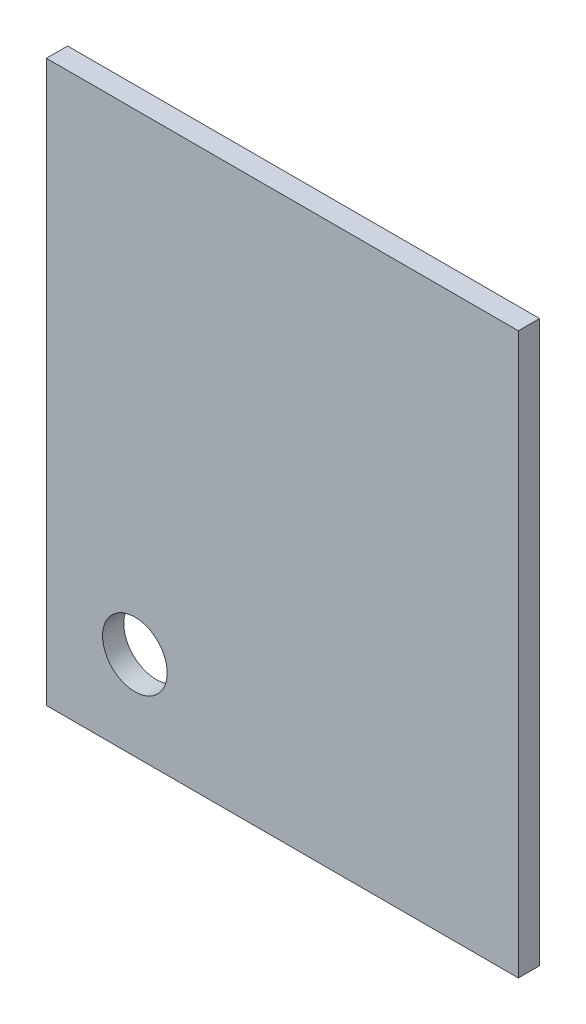
from build123d import *

# Parameters (mm, degrees)
SKETCH1_W      = 50.8
SKETCH1_H      = 60.325
SKETCH1_R      = 3.480052618
EXTRUDE2_DEPTH = 2.286


with BuildPart() as part:
    # Sketch1 → Extrude2 (new body)
    with BuildSketch(Plane.XY):
        with Locations((25.4, 30.1625)):
            Rectangle(SKETCH1_W, SKETCH1_H)
        with Locations((9.525, 9.525)):
            Circle(SKETCH1_R, mode=Mode.SUBTRACT)
    extrude(amount=-EXTRUDE2_DEPTH)


solid = part.part
